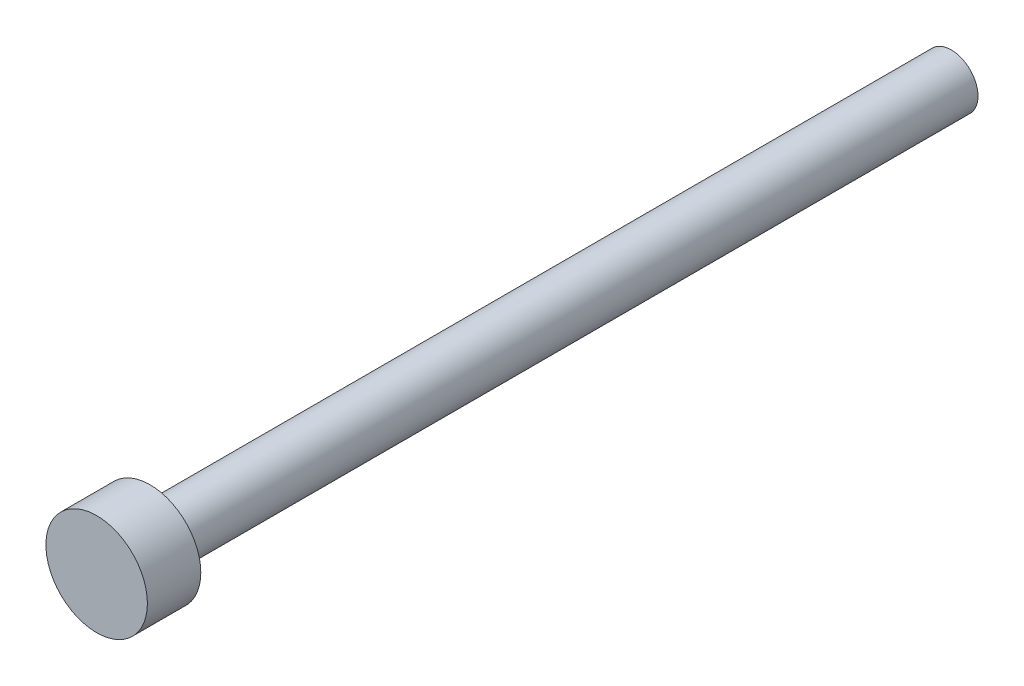
from build123d import *

# Parameters (mm, degrees)
SHANK_NOMINAL_THREAD_ENVELOPE_START     = -30
SHANK_NOMINAL_THREAD_ENVELOPE_PROFILE_R = 1
SHANK_NOMINAL_THREAD_ENVELOPE_DEPTH     = 30
SOCKET_HEAD_ENVELOPE_PROFILE_R          = 1.9
SOCKET_HEAD_ENVELOPE_DEPTH              = 2


with BuildPart() as part:
    # Shank_nominal_thread_envelope_profile → Shank_nominal_thread_envelope (new body)
    with BuildSketch(Plane.XY.offset(SHANK_NOMINAL_THREAD_ENVELOPE_START)):
        Circle(SHANK_NOMINAL_THREAD_ENVELOPE_PROFILE_R)
    extrude(amount=SHANK_NOMINAL_THREAD_ENVELOPE_DEPTH)

    # Socket_head_envelope_profile → Socket_head_envelope (add)
    with BuildSketch(Plane.XY):
        Circle(SOCKET_HEAD_ENVELOPE_PROFILE_R)
    extrude(amount=SOCKET_HEAD_ENVELOPE_DEPTH)


solid = part.part
